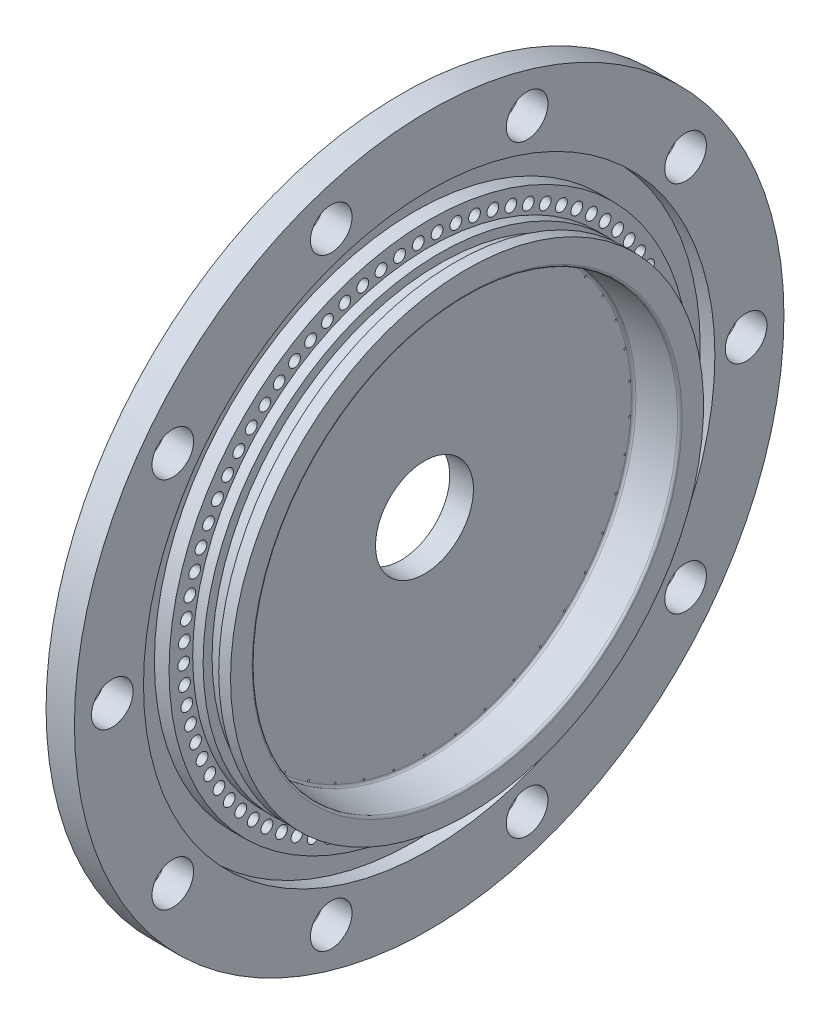
from build123d import *

# Parameters (mm, degrees)
SKETCH5_R          = 1.25
CUT_EXTRUDE1_DEPTH = 107.367288205
CIRPATTERN1_COUNT  = 82
SKETCH6_R          = 4.4
CUT_EXTRUDE2_DEPTH = 107.367288205
CIRPATTERN2_COUNT  = 10
CUT_EXTRUDE3_REACH = 108.447
SKETCH9_R          = 0.2
SKETCH10_R         = 0.7
CUT_EXTRUDE4_DEPTH = 3.8
CIRPATTERN3_COUNT  = 42


with BuildPart() as part:
    # Sketch4 → Revolve2 (revolve)
    with BuildSketch(Plane.XY, mode=Mode.PRIVATE) as revolve2_sk:
        with BuildLine():
            Line((0, 10.35), (0, 75))
            Line((0, 75), (6, 75))
            Line((6, 75), (6, 60.4))
            Line((6, 60.4), (2.9, 60.4))
            Line((2.9, 60.4), (2.9, 55))
            Line((2.9, 55), (6, 55))
            Line((6, 55), (6, 50))
            Line((6, 50), (8.2, 50))
            Line((8.2, 50), (8.2, 48.1))
            Line((8.2, 48.1), (11.5, 48.1))
            Line((11.5, 48.1), (11.5, 50))
            Line((11.5, 50), (14, 50))
            Line((14, 50), (14, 45.458165587))
            ThreePointArc((14, 45.458165587), (13.868638668, 45.120370483), (13.543577871, 44.960068238))
            Line((13.543577871, 44.960068238), (5.456422129, 44.25253379))
            ThreePointArc((5.456422129, 44.25253379), (5.131361332, 44.092231545), (5, 43.754436441))
            Line((5, 43.754436441), (5, 10.35))
            Line((5, 10.35), (0, 10.35))
        make_face()
    revolve(revolve2_sk.sketch.rotate(Axis((0, 0, 0), (1, 0, 0)), 90), axis=Axis((0, 0, 0), (1, 0, 0)))

    # Sketch5 → Cut-Extrude1 (cut, symmetric)
    with BuildSketch(Plane(origin=(6, 0, 0), x_dir=(0, 0, -1), z_dir=(1, 0, 0))):
        with Locations((1.675486715, 51.872948097)):
            Circle(SKETCH5_R)
    cut_extrude1 = extrude(amount=CUT_EXTRUDE1_DEPTH, both=True, mode=Mode.SUBTRACT)

    # CirPattern1: Cut-Extrude1 ×82 about axis
    cirpattern1_axis = Axis((0, 0, 0), (1, 0, 0))
    for i in range(1, CIRPATTERN1_COUNT):
        add(cut_extrude1.rotate(cirpattern1_axis, i * 360 / CIRPATTERN1_COUNT), mode=Mode.SUBTRACT)

    # Sketch6 → Cut-Extrude2 (cut, through all)
    with BuildSketch(Plane(origin=(6, 0, 0), x_dir=(0, 0, -1), z_dir=(1, 0, 0))):
        with Locations((67, 0)):
            Circle(SKETCH6_R)
    cut_extrude2 = extrude(amount=-CUT_EXTRUDE2_DEPTH, mode=Mode.SUBTRACT)

    # CirPattern2: Cut-Extrude2 ×10 about axis
    cirpattern2_axis = Axis((0, 0, 0), (1, 0, 0))
    for i in range(1, CIRPATTERN2_COUNT):
        add(cut_extrude2.rotate(cirpattern2_axis, i * 360 / CIRPATTERN2_COUNT), mode=Mode.SUBTRACT)

    # Sketch9 → Cut-Extrude3 (cut, up to next)
    with BuildSketch(Plane(origin=(5, 0, 0), x_dir=(0, 0, -1), z_dir=(1, 0, 0)), mode=Mode.PRIVATE) as cut_extrude3_sk1:
        with Locations((0, 43.5)):
            Circle(SKETCH9_R)
    cut_extrude3_tool1 = extrude(cut_extrude3_sk1.sketch, amount=-CUT_EXTRUDE3_REACH, mode=Mode.PRIVATE) & part.part
    cut_extrude3 = cut_extrude3_tool1.solids().sort_by_distance((5, 43.5, 0))[0]
    add(cut_extrude3, mode=Mode.SUBTRACT)

    # Sketch10 → Cut-Extrude4 (cut)
    with BuildSketch(Plane.ZY):
        with Locations((0, 43.5)):
            Circle(SKETCH10_R)
    cut_extrude4 = extrude(amount=-CUT_EXTRUDE4_DEPTH, mode=Mode.SUBTRACT)

    # CirPattern3: Cut-Extrude3, Cut-Extrude4 ×42 about axis
    cirpattern3_axis = Axis((0, 0, 0), (1, 0, 0))
    add([cut_extrude3.rotate(cirpattern3_axis, i * 360 / CIRPATTERN3_COUNT) for i in range(1, CIRPATTERN3_COUNT)], mode=Mode.SUBTRACT)
    add([cut_extrude4.rotate(cirpattern3_axis, i * 360 / CIRPATTERN3_COUNT) for i in range(1, CIRPATTERN3_COUNT)], mode=Mode.SUBTRACT)


solid = part.part
